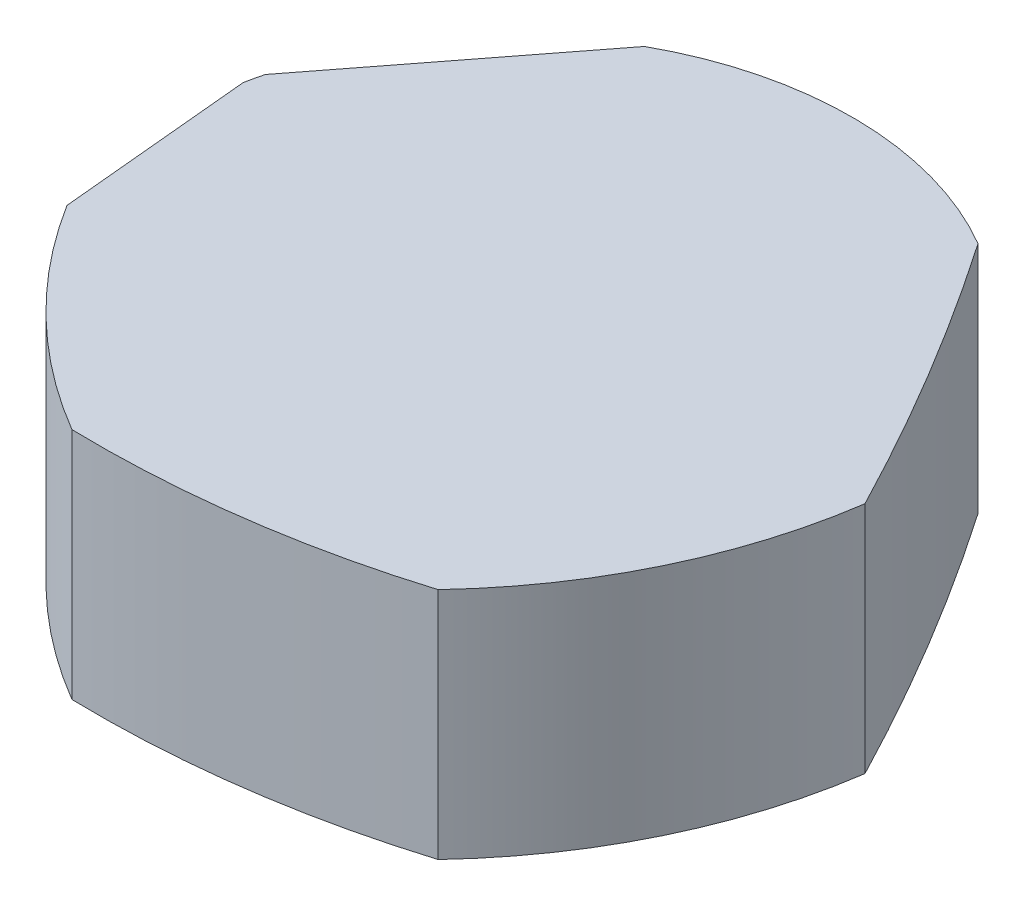
from build123d import *

# Parameters (mm, degrees)
BOSS_EXTRUDE1_DEPTH = 100


with BuildPart() as part:
    # Sketch1 → Boss-Extrude1 (new body)
    with BuildSketch(Plane(origin=(0, 0, 0), x_dir=(1, 0, 0), z_dir=(0, 1, 0))):
        with BuildLine():
            Line((-135.351509673, -54.659892728), (-143.16186287, 28.502913245))
            ThreePointArc((-143.16186287, 28.502913245), (-142.333418361, 32.387236089), (-141.399603301, 36.247582406))
            Line((-141.399603301, 36.247582406), (-70.729724798, 127.691194191))
            ThreePointArc((-70.729724798, 127.691194191), (1.701551679, 145.961775016), (73.687223064, 126.007651359))
            ThreePointArc((73.687223064, 126.007651359), (111.65776791, 66.863352087), (145.869241729, 5.468030837))
            ThreePointArc((145.869241729, 5.468030837), (125.636702297, -60.683640158), (86.399335375, -117.655811121))
            ThreePointArc((86.399335375, -117.655811121), (18.367849273, -132.71304327), (-51.195880989, -136.699366544))
            ThreePointArc((-51.195880989, -136.699366544), (-98.238828154, -100.772834831), (-135.351509673, -54.659892728))
        make_face()
    extrude(amount=BOSS_EXTRUDE1_DEPTH)


solid = part.part
